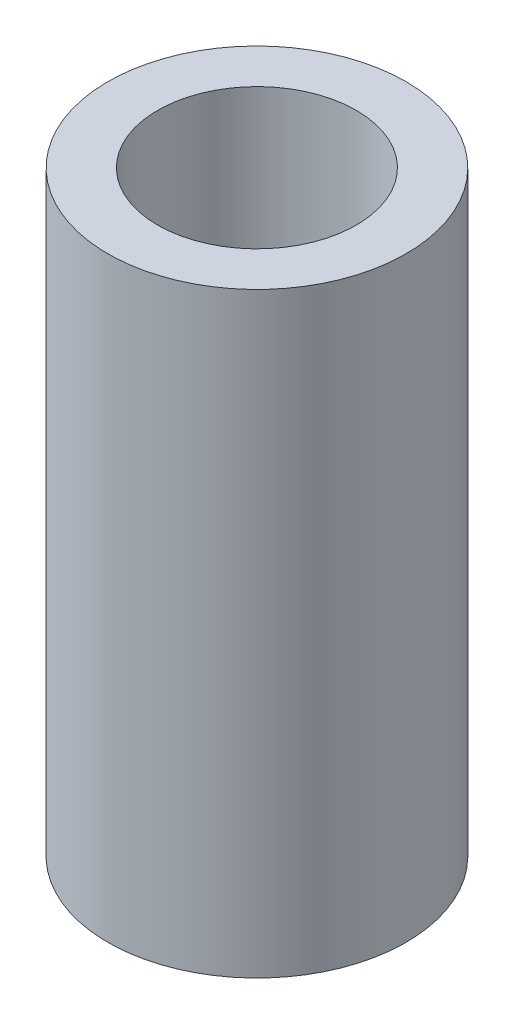
from build123d import *

# Parameters (mm, degrees)
SKETCH1_R           = 2.38125
SKETCH1_R_2         = 1.5875
BOSS_EXTRUDE1_DEPTH = 9.525


with BuildPart() as part:
    # Sketch1 → Boss-Extrude1 (new body)
    with BuildSketch(Plane(origin=(0, 0, 0), x_dir=(1, 0, 0), z_dir=(0, 1, 0))):
        with Locations(Location((0, 0, 0), (0, 0, 90))):
            Circle(SKETCH1_R)
        with Locations(Location((0, 0, 0), (0, 0, 90))):
            Circle(SKETCH1_R_2, mode=Mode.SUBTRACT)
    extrude(amount=BOSS_EXTRUDE1_DEPTH)


solid = part.part
